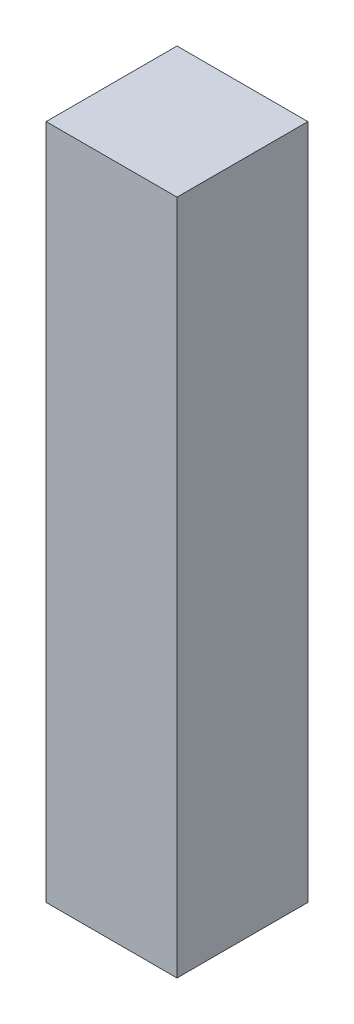
from build123d import *

# Parameters (mm, degrees)
SKETCH1_W           = 19.05
SKETCH1_H           = 19.05
BOSS_EXTRUDE1_DEPTH = 98.425


with BuildPart() as part:
    # Sketch1 → Boss-Extrude1 (new body)
    with BuildSketch(Plane(origin=(0, 0, 0), x_dir=(1, 0, 0), z_dir=(0, 1, 0))):
        with Locations((9.525, 9.525)):
            Rectangle(SKETCH1_W, SKETCH1_H)
    extrude(amount=BOSS_EXTRUDE1_DEPTH)


solid = part.part
